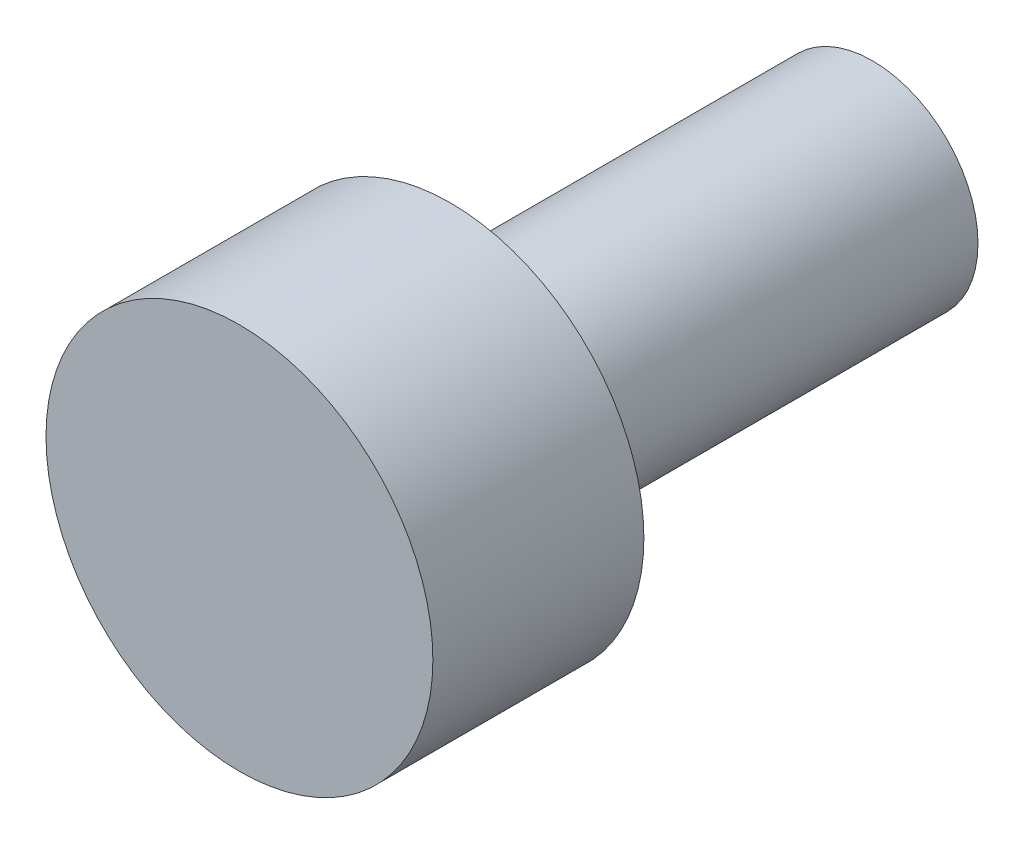
from build123d import *

# Parameters (mm, degrees)
SKETCH_1_R        = 1.5
EXTRUDE_M3_DEPTH  = 6
EXTRUDE_START     = 6
SKETCH_2_R        = 2.75
EXTRUDE_265_DEPTH = 3


with BuildPart() as part:
    # 草图1 → M3杆 (new body)
    with BuildSketch(Plane.XY):
        Circle(SKETCH_1_R)
    extrude(amount=EXTRUDE_M3_DEPTH)

    # 草图2 → Extrude 265 (add)
    with BuildSketch(Plane.XY.offset(EXTRUDE_START)):
        Circle(SKETCH_2_R)
    extrude(amount=EXTRUDE_265_DEPTH)


solid = part.part
